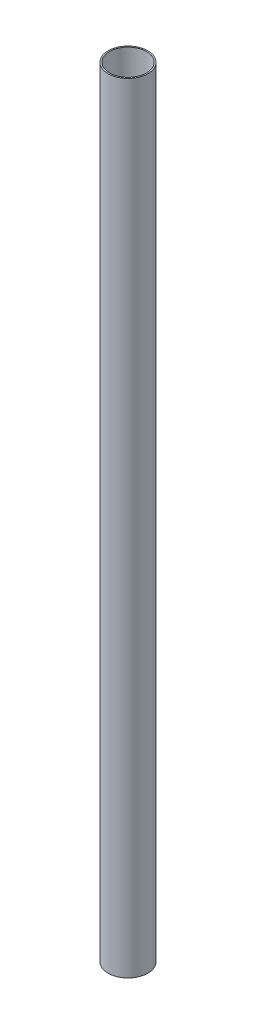
from build123d import *

# Parameters (mm, degrees)
SKETCH1_R           = 5.101343433
SKETCH1_R_2         = 4.760409882
BOSS_EXTRUDE1_DEPTH = 200


with BuildPart() as part:
    # Sketch1 → Boss-Extrude1 (new body)
    with BuildSketch(Plane(origin=(0, 0, 0), x_dir=(1, 0, 0), z_dir=(0, 1, 0))):
        with Locations(Location((0, 0, 0), (0, 0, 270))):
            Circle(SKETCH1_R)
        with Locations(Location((0, 0, 0), (0, 0, 270))):
            Circle(SKETCH1_R_2, mode=Mode.SUBTRACT)
    extrude(amount=BOSS_EXTRUDE1_DEPTH)


solid = part.part
